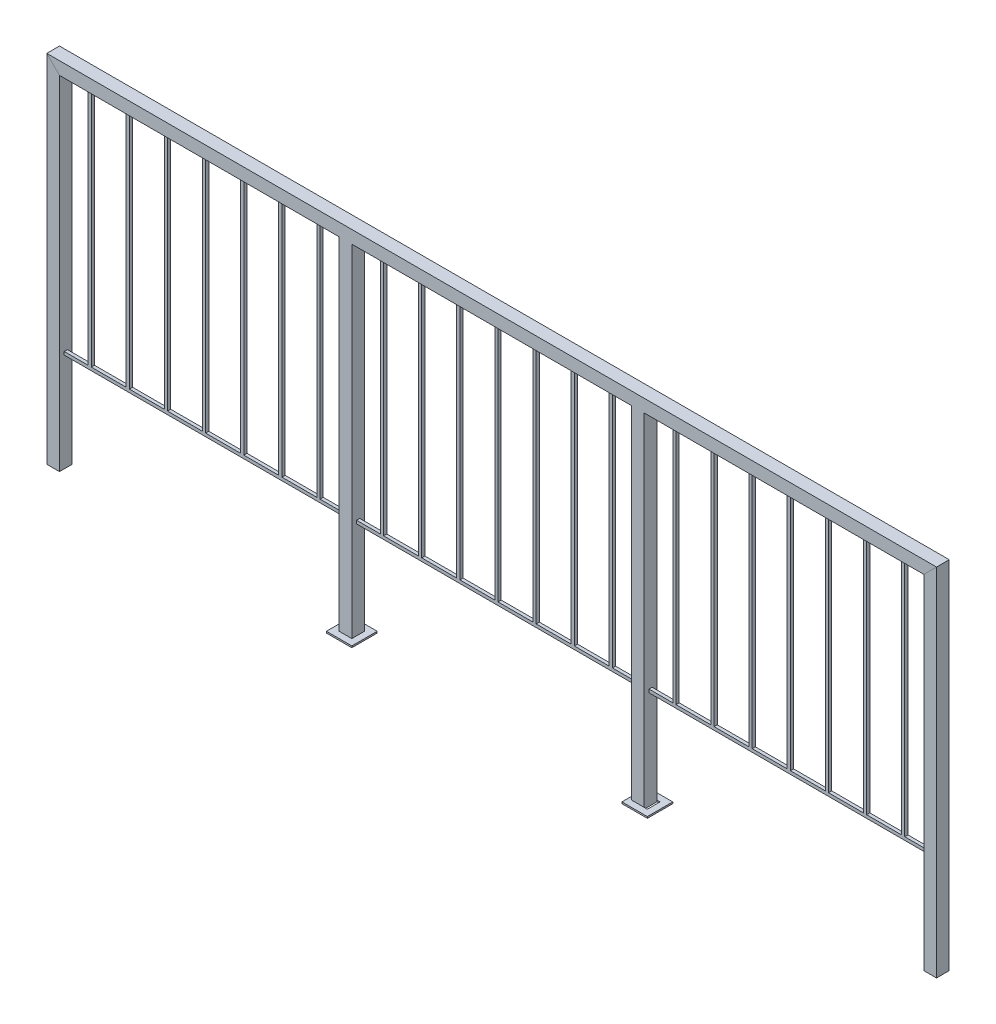
from build123d import *

# Parameters (mm, degrees)
SKETCH_2_W                           = 40
SKETCH_2_H                           = 40
SKETCH_4_W                           = 40
SKETCH_4_H                           = 40
EXTRUDE_1_DEPTH                      = 1080
EXTRUDE_2_REACH                      = 2980.657
SKETCH_5_W                           = 10
SKETCH_5_H                           = 10
SKETCH_6_W                           = 10
SKETCH_6_H                           = 10
EXTRUDE_3_DEPTH                      = 760
PATTERN_LINEAR_2_COUNT               = 4
PATTERN_LINEAR_2_PITCH               = 120
PATTERN_LINEAR_2_COL_COUNT           = 4
PATTERN_LINEAR_2_COL_PITCH           = 120
PATTERN_LINEAR_3_COUNT               = 2
PATTERN_LINEAR_3_PITCH               = 920
PATTERN_LINEAR_3_COPY_1_SKETCH_W     = 10
PATTERN_LINEAR_3_COPY_1_SKETCH_H     = 10
PATTERN_LINEAR_3_COPY_1_DEPTH        = 760
PATTERN_LINEAR_3_COPY_2_SKETCH_W     = 10
PATTERN_LINEAR_3_COPY_2_SKETCH_H     = 10
PATTERN_LINEAR_3_COPY_2_DEPTH        = 760
PATTERN_LINEAR_3_COPY_3_SKETCH_W     = 10
PATTERN_LINEAR_3_COPY_3_SKETCH_H     = 10
PATTERN_LINEAR_3_COPY_3_DEPTH        = 760
PATTERN_LINEAR_3_COPY_4_SKETCH_W     = 10
PATTERN_LINEAR_3_COPY_4_SKETCH_H     = 10
PATTERN_LINEAR_3_COPY_4_DEPTH        = 760
PATTERN_LINEAR_3_COPY_5_SKETCH_W     = 10
PATTERN_LINEAR_3_COPY_5_SKETCH_H     = 10
PATTERN_LINEAR_3_COPY_5_DEPTH        = 760
PATTERN_LINEAR_3_COPY_6_SKETCH_W     = 10
PATTERN_LINEAR_3_COPY_6_SKETCH_H     = 10
PATTERN_LINEAR_3_COPY_6_DEPTH        = 760
PATTERN_LINEAR_3_COL_COUNT           = 2
PATTERN_LINEAR_3_COL_PITCH           = 920
PATTERN_LINEAR_3_COL_COPY_1_SKETCH_W = 10
PATTERN_LINEAR_3_COL_COPY_1_SKETCH_H = 10
PATTERN_LINEAR_3_COL_COPY_1_DEPTH    = 760
PATTERN_LINEAR_3_COL_COPY_2_SKETCH_W = 10
PATTERN_LINEAR_3_COL_COPY_2_SKETCH_H = 10
PATTERN_LINEAR_3_COL_COPY_2_DEPTH    = 760
PATTERN_LINEAR_3_COL_COPY_3_SKETCH_W = 10
PATTERN_LINEAR_3_COL_COPY_3_SKETCH_H = 10
PATTERN_LINEAR_3_COL_COPY_3_DEPTH    = 760
PATTERN_LINEAR_3_COL_COPY_4_SKETCH_W = 10
PATTERN_LINEAR_3_COL_COPY_4_SKETCH_H = 10
PATTERN_LINEAR_3_COL_COPY_4_DEPTH    = 760
PATTERN_LINEAR_3_COL_COPY_5_SKETCH_W = 10
PATTERN_LINEAR_3_COL_COPY_5_SKETCH_H = 10
PATTERN_LINEAR_3_COL_COPY_5_DEPTH    = 760
PATTERN_LINEAR_3_COL_COPY_6_SKETCH_W = 10
PATTERN_LINEAR_3_COL_COPY_6_SKETCH_H = 10
PATTERN_LINEAR_3_COL_COPY_6_DEPTH    = 760
SKETCH_7_W                           = 80
SKETCH_7_H                           = 80
SKETCH_7_W_2                         = 40
SKETCH_7_H_2                         = 40
EXTRUDE_4_DEPTH                      = 5
PATTERN_LINEAR_4_COUNT               = 2
PATTERN_LINEAR_4_PITCH               = 930


with BuildPart() as part:
    # По траектории2: sweep along a curve in space
    with BuildLine() as sweep_2_path:
        Line((0, 0, 0), (0, 1100, 0))
        Line((0, 1100, 0), (2760, 1100, 0))
        Line((2760, 1100, 0), (2760, 0, 0))
    # Эскиз2 → По траектории2 (sweep)
    with BuildSketch(Plane(origin=(0, 0, 0), x_dir=(1, 0, 0), z_dir=(0, 1, 0))):
        Rectangle(SKETCH_2_W, SKETCH_2_H)
    sweep(path=sweep_2_path.line, transition=Transition.RIGHT)

    # Эскиз4 → Бобышка-Вытянуть1 (add)
    with BuildSketch(Plane.XZ.offset(-1080)):
        with Locations((920, 0)):
            Rectangle(SKETCH_4_W, SKETCH_4_H)
        with Locations((1840, 0)):
            Rectangle(SKETCH_4_W, SKETCH_4_H)
    extrude(amount=EXTRUDE_1_DEPTH)

    # Бобышка-Вытянуть2: up to this face of the body (flat: up to its plane)
    extrude_2_end = Plane(part.part.faces().sort_by_distance((2740, 540, 0))[0])
    # Эскиз5 → Бобышка-Вытянуть2 (add, up to the picked face)
    with BuildSketch(Plane(origin=(20, 0, 0), x_dir=(0, 0, -1), z_dir=(1, 0, 0)), mode=Mode.PRIVATE) as extrude_2_sk1:
        with Locations((0, 315)):
            Rectangle(SKETCH_5_W, SKETCH_5_H)
    extrude_2_tool1 = split(extrude(extrude_2_sk1.sketch, amount=EXTRUDE_2_REACH, mode=Mode.PRIVATE), bisect_by=extrude_2_end, keep=Keep.BOTH, mode=Mode.PRIVATE)
    add(extrude_2_tool1.solids().sort_by(Axis((20, 315, 0), (1, 0, 0)))[0])

    # Эскиз6 → Бобышка-Вытянуть3 (add)
    with BuildSketch(Plane(origin=(0, 320, 0), x_dir=(1, 0, 0), z_dir=(0, 1, 0))):
        with Locations((1380, 0)):
            Rectangle(SKETCH_6_W, SKETCH_6_H)
    extrude_3 = extrude(amount=EXTRUDE_3_DEPTH)

    # Линейный массив2: Бобышка-Вытянуть3 ×4
    with Locations(*[(-i * PATTERN_LINEAR_2_PITCH, 0, 0) for i in range(1, PATTERN_LINEAR_2_COUNT)]):
        add(extrude_3)

    # Линейный массив2 col: Бобышка-Вытянуть3 ×4
    with Locations(*[(i * PATTERN_LINEAR_2_COL_PITCH, 0, 0) for i in range(1, PATTERN_LINEAR_2_COL_COUNT)]):
        add(extrude_3)

    # Линейный массив3: Бобышка-Вытянуть3 ×2
    with Locations(*[(-i * PATTERN_LINEAR_3_PITCH, 0, 0) for i in range(1, PATTERN_LINEAR_3_COUNT)]):
        add(extrude_3)

    # Линейный массив3 copy 1 sketch → Линейный массив3 copy 1 (add)
    with BuildSketch(Plane(origin=(-1040, 320, 0), x_dir=(1, 0, 0), z_dir=(0, 1, 0))):
        with Locations((1380, 0)):
            Rectangle(PATTERN_LINEAR_3_COPY_1_SKETCH_W, PATTERN_LINEAR_3_COPY_1_SKETCH_H)
    extrude(amount=PATTERN_LINEAR_3_COPY_1_DEPTH)

    # Линейный массив3 copy 2 sketch → Линейный массив3 copy 2 (add)
    with BuildSketch(Plane(origin=(-1160, 320, 0), x_dir=(1, 0, 0), z_dir=(0, 1, 0))):
        with Locations((1380, 0)):
            Rectangle(PATTERN_LINEAR_3_COPY_2_SKETCH_W, PATTERN_LINEAR_3_COPY_2_SKETCH_H)
    extrude(amount=PATTERN_LINEAR_3_COPY_2_DEPTH)

    # Линейный массив3 copy 3 sketch → Линейный массив3 copy 3 (add)
    with BuildSketch(Plane(origin=(-1280, 320, 0), x_dir=(1, 0, 0), z_dir=(0, 1, 0))):
        with Locations((1380, 0)):
            Rectangle(PATTERN_LINEAR_3_COPY_3_SKETCH_W, PATTERN_LINEAR_3_COPY_3_SKETCH_H)
    extrude(amount=PATTERN_LINEAR_3_COPY_3_DEPTH)

    # Линейный массив3 copy 4 sketch → Линейный массив3 copy 4 (add)
    with BuildSketch(Plane(origin=(-800, 320, 0), x_dir=(1, 0, 0), z_dir=(0, 1, 0))):
        with Locations((1380, 0)):
            Rectangle(PATTERN_LINEAR_3_COPY_4_SKETCH_W, PATTERN_LINEAR_3_COPY_4_SKETCH_H)
    extrude(amount=PATTERN_LINEAR_3_COPY_4_DEPTH)

    # Линейный массив3 copy 5 sketch → Линейный массив3 copy 5 (add)
    with BuildSketch(Plane(origin=(-680, 320, 0), x_dir=(1, 0, 0), z_dir=(0, 1, 0))):
        with Locations((1380, 0)):
            Rectangle(PATTERN_LINEAR_3_COPY_5_SKETCH_W, PATTERN_LINEAR_3_COPY_5_SKETCH_H)
    extrude(amount=PATTERN_LINEAR_3_COPY_5_DEPTH)

    # Линейный массив3 copy 6 sketch → Линейный массив3 copy 6 (add)
    with BuildSketch(Plane(origin=(-560, 320, 0), x_dir=(1, 0, 0), z_dir=(0, 1, 0))):
        with Locations((1380, 0)):
            Rectangle(PATTERN_LINEAR_3_COPY_6_SKETCH_W, PATTERN_LINEAR_3_COPY_6_SKETCH_H)
    extrude(amount=PATTERN_LINEAR_3_COPY_6_DEPTH)

    # Линейный массив3 col: Бобышка-Вытянуть3 ×2
    with Locations(*[(i * PATTERN_LINEAR_3_COL_PITCH, 0, 0) for i in range(1, PATTERN_LINEAR_3_COL_COUNT)]):
        add(extrude_3)

    # Линейный массив3 col copy 1 sketch → Линейный массив3 col copy 1 (add)
    with BuildSketch(Plane(origin=(800, 320, 0), x_dir=(1, 0, 0), z_dir=(0, 1, 0))):
        with Locations((1380, 0)):
            Rectangle(PATTERN_LINEAR_3_COL_COPY_1_SKETCH_W, PATTERN_LINEAR_3_COL_COPY_1_SKETCH_H)
    extrude(amount=PATTERN_LINEAR_3_COL_COPY_1_DEPTH)

    # Линейный массив3 col copy 2 sketch → Линейный массив3 col copy 2 (add)
    with BuildSketch(Plane(origin=(680, 320, 0), x_dir=(1, 0, 0), z_dir=(0, 1, 0))):
        with Locations((1380, 0)):
            Rectangle(PATTERN_LINEAR_3_COL_COPY_2_SKETCH_W, PATTERN_LINEAR_3_COL_COPY_2_SKETCH_H)
    extrude(amount=PATTERN_LINEAR_3_COL_COPY_2_DEPTH)

    # Линейный массив3 col copy 3 sketch → Линейный массив3 col copy 3 (add)
    with BuildSketch(Plane(origin=(560, 320, 0), x_dir=(1, 0, 0), z_dir=(0, 1, 0))):
        with Locations((1380, 0)):
            Rectangle(PATTERN_LINEAR_3_COL_COPY_3_SKETCH_W, PATTERN_LINEAR_3_COL_COPY_3_SKETCH_H)
    extrude(amount=PATTERN_LINEAR_3_COL_COPY_3_DEPTH)

    # Линейный массив3 col copy 4 sketch → Линейный массив3 col copy 4 (add)
    with BuildSketch(Plane(origin=(1040, 320, 0), x_dir=(1, 0, 0), z_dir=(0, 1, 0))):
        with Locations((1380, 0)):
            Rectangle(PATTERN_LINEAR_3_COL_COPY_4_SKETCH_W, PATTERN_LINEAR_3_COL_COPY_4_SKETCH_H)
    extrude(amount=PATTERN_LINEAR_3_COL_COPY_4_DEPTH)

    # Линейный массив3 col copy 5 sketch → Линейный массив3 col copy 5 (add)
    with BuildSketch(Plane(origin=(1160, 320, 0), x_dir=(1, 0, 0), z_dir=(0, 1, 0))):
        with Locations((1380, 0)):
            Rectangle(PATTERN_LINEAR_3_COL_COPY_5_SKETCH_W, PATTERN_LINEAR_3_COL_COPY_5_SKETCH_H)
    extrude(amount=PATTERN_LINEAR_3_COL_COPY_5_DEPTH)

    # Линейный массив3 col copy 6 sketch → Линейный массив3 col copy 6 (add)
    with BuildSketch(Plane(origin=(1280, 320, 0), x_dir=(1, 0, 0), z_dir=(0, 1, 0))):
        with Locations((1380, 0)):
            Rectangle(PATTERN_LINEAR_3_COL_COPY_6_SKETCH_W, PATTERN_LINEAR_3_COL_COPY_6_SKETCH_H)
    extrude(amount=PATTERN_LINEAR_3_COL_COPY_6_DEPTH)

    # Эскиз7 → Бобышка-Вытянуть4 (add)
    with BuildSketch(Plane(origin=(0, 0, 0), x_dir=(-1, 0, 0), z_dir=(0, 1, 0))):
        with Locations((-920, 0)):
            Rectangle(SKETCH_7_W, SKETCH_7_H)
        with Locations((-920, 0)):
            Rectangle(SKETCH_7_W_2, SKETCH_7_H_2, mode=Mode.SUBTRACT)
    extrude_4 = extrude(amount=EXTRUDE_4_DEPTH)

    # Линейный массив4: Бобышка-Вытянуть4 ×2
    with Locations(*[(i * PATTERN_LINEAR_4_PITCH, 0, 0) for i in range(1, PATTERN_LINEAR_4_COUNT)]):
        add(extrude_4)


solid = part.part
